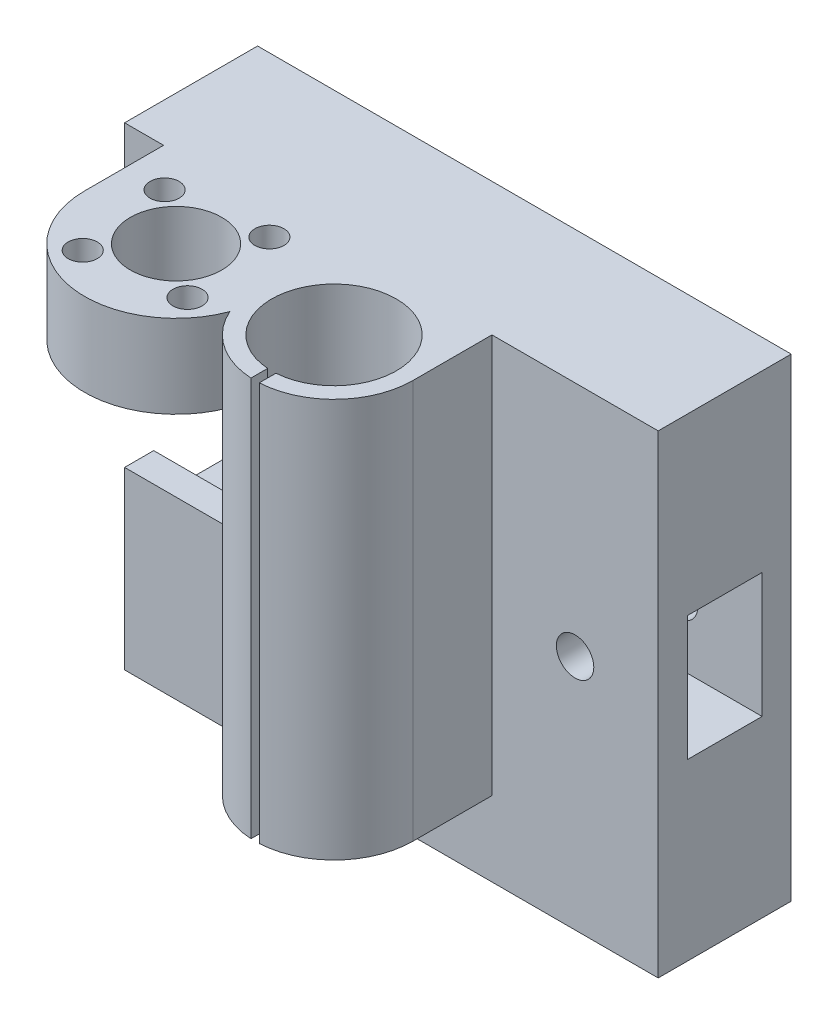
from build123d import *

# Parameters (mm, degrees)
SKETCH1_R            = 5.5
SKETCH1_R_2          = 1.75
BOSS_EXTRUDE1_DEPTH  = 28.5
CUT_EXTRUDE1_DEPTH   = 74.164092839
SKETCH3_W            = 9
SKETCH3_H            = 25
CUT_EXTRUDE2_DEPTH   = 28
SKETCH4_W            = 16
SKETCH4_H            = 14.8
CUT_EXTRUDE3_DEPTH   = 26.000210526
M4_CLEARANCE_HOLE1_D = 4.5
SKETCH6_R            = 3.994459126
SKETCH6_R_2          = 4.1
CUT_EXTRUDE4_DEPTH   = 30
SKETCH7_W            = 9
SKETCH7_H            = 15
CUT_EXTRUDE5_DEPTH   = 59.773195259


with BuildPart() as part:
    # Sketch1 → Boss-Extrude1 (new, symmetric)
    with BuildSketch(Plane(origin=(0, 0, 0), x_dir=(1, 0, 0), z_dir=(0, 1, 0))):
        with BuildLine():
            Line((0, 0), (64.191, 0))
            Line((64.191, 0), (64.191, -16))
            Line((64.191, -16), (44.191, -16))
            Line((44.191, -16), (44.191, -25.5))
            ThreePointArc((44.191, -25.5), (41.583024376, -32.038348415), (35.191, -34.986832981))
            Line((35.191, -34.986832981), (35.191, -32.983314774))
            ThreePointArc((35.191, -32.983314774), (34.691, -18), (34.191, -32.983314774))
            Line((34.191, -32.983314774), (34.191, -34.986832981))
            ThreePointArc((34.191, -34.986832981), (29.296680203, -33.319930558), (26.000210526, -29.336688458))
            ThreePointArc((26.000210526, -29.336688458), (13.741809885, -36.325925267), (4.691, -25.5))
            Line((4.691, -25.5), (4.691, -16))
            Line((4.691, -16), (0, -16))
            Line((0, -16), (0, 0))
        make_face()
        with Locations(Location((15.691, -25.5, 0), (0, 0, 90))):
            Circle(SKETCH1_R, mode=Mode.SUBTRACT)
        with Locations(Location((10.765708197, -31.804086029, 0), (0, 0, 90))):
            Circle(SKETCH1_R_2, mode=Mode.SUBTRACT)
        with Locations(Location((9.386913971, -20.574708197, 0), (0, 0, 90))):
            Circle(SKETCH1_R_2, mode=Mode.SUBTRACT)
        with Locations(Location((20.616291803, -19.195913971, 0), (0, 0, 90))):
            Circle(SKETCH1_R_2, mode=Mode.SUBTRACT)
        with Locations(Location((21.995086029, -30.425291803, 0), (0, 0, 90))):
            Circle(SKETCH1_R_2, mode=Mode.SUBTRACT)
    extrude(amount=BOSS_EXTRUDE1_DEPTH, both=True)

    # Sketch2 → Cut-Extrude1 (cut, through all)
    with BuildSketch(Plane.XY.offset(16)):
        Polygon((4.691, 18.5), (26.000210526, 18.5), (26.000210526, -19.5), (44.191, -19.5), (44.191, -28.5), (4.691, -28.5), align=None)
    extrude(amount=CUT_EXTRUDE1_DEPTH, mode=Mode.SUBTRACT)

    # Sketch3 → Cut-Extrude2 (cut)
    with BuildSketch(Plane.ZY):
        with Locations((8, 0)):
            Rectangle(SKETCH3_W, SKETCH3_H)
    extrude(amount=-CUT_EXTRUDE2_DEPTH, mode=Mode.SUBTRACT)

    # Sketch4 → Cut-Extrude3 (cut)
    with BuildSketch(Plane.ZY):
        with Locations((8, 0)):
            Rectangle(SKETCH4_W, SKETCH4_H)
    extrude(amount=-CUT_EXTRUDE3_DEPTH, mode=Mode.SUBTRACT)

    # M4 Clearance Hole1 (through all)
    with Locations(Plane(origin=(54.191, 0, 16), x_dir=(1, 0, 0), z_dir=(0, 0, 1))):
        with Locations((0, 0)):
            Hole(M4_CLEARANCE_HOLE1_D / 2)

    # Sketch6 → Cut-Extrude4 (cut)
    with BuildSketch(Plane.ZY):
        with Locations((8, -22.5)):
            Circle(SKETCH6_R)
        with Locations((8, 22.5)):
            Circle(SKETCH6_R_2)
    extrude(amount=-CUT_EXTRUDE4_DEPTH, mode=Mode.SUBTRACT)

    # Sketch7 → Cut-Extrude5 (cut, through all)
    with BuildSketch(Plane.ZY.offset(-28)):
        with Locations((8, 0)):
            Rectangle(SKETCH7_W, SKETCH7_H)
    extrude(amount=-CUT_EXTRUDE5_DEPTH, mode=Mode.SUBTRACT)


solid = part.part
